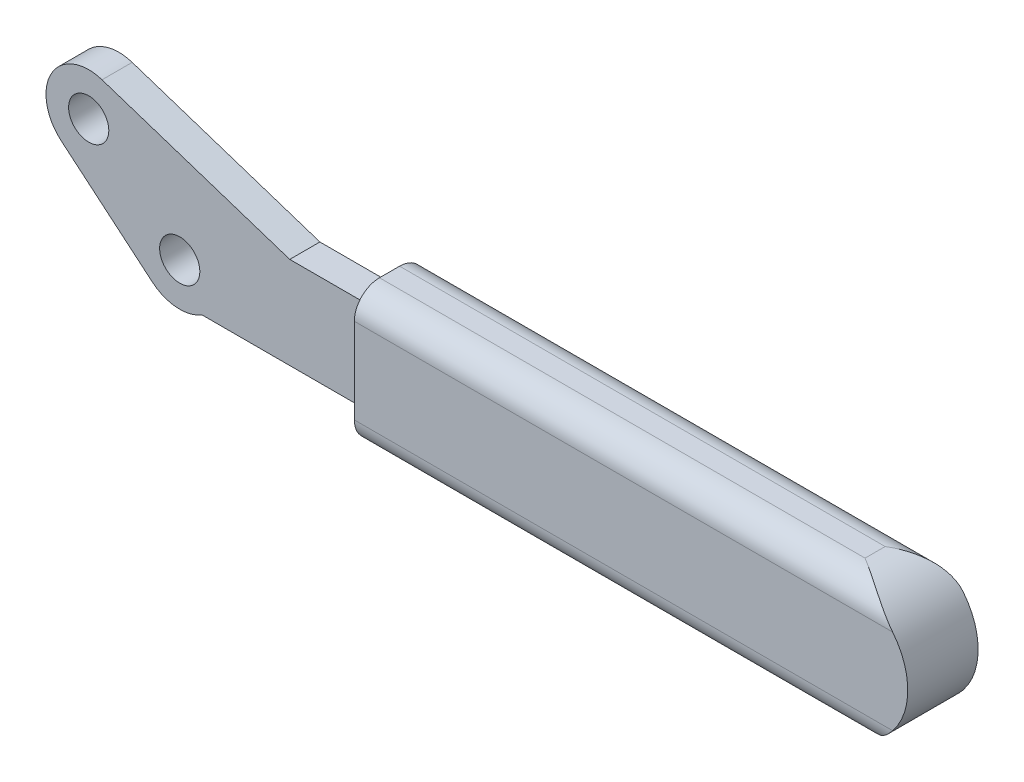
from build123d import *

# Parameters (mm, degrees)
EXTRUDE_1_DEPTH          = 3
EXTRUDE_1_DEPTH_BACK     = 3
SKETCH_1_R               = 4
EXTRUDE_2_DEPTH          = 110.134
CUT_EXTRUDE_1_DEPTH      = 7
CUT_EXTRUDE_1_DEPTH_BACK = 7


with BuildPart() as part:
    # 草图1 → 凸台-拉伸1 (new, two sides: drawn at the far end of the back side and taken through both)
    with BuildSketch(Plane.XY.offset(-EXTRUDE_1_DEPTH_BACK)):
        with BuildLine():
            Line((-23.589809211, 8.747299509), (-5.474019211, -6.502700491))
            ThreePointArc((-5.474019211, -6.502700491), (-0.63908945, -8.475940342), (4.437059837, -7.25))
            Line((4.437059837, -7.25), (38.75, -7.25))
            Line((38.75, -7.25), (38.75, 11.05))
            Line((38.75, 11.05), (21.8949318, 11.05))
            Line((21.8949318, 11.05), (-15.462352545, 23.325225673))
            ThreePointArc((-15.462352545, 23.325225673), (-25.539933262, 19.389093721), (-23.589809211, 8.747299509))
        make_face()
        Circle(SKETCH_1_R, mode=Mode.SUBTRACT)
        with Locations((-18.11579, 15.25)):
            Circle(SKETCH_1_R, mode=Mode.SUBTRACT)
    extrude(amount=EXTRUDE_1_DEPTH + EXTRUDE_1_DEPTH_BACK)

    # 草图2 → 凸台-拉伸2 (add)
    with BuildSketch(Plane(origin=(38.75, 0, 0), x_dir=(0, 0, -1), z_dir=(1, 0, 0))):
        with BuildLine():
            Line((-7, 10.81), (-7, -6.19))
            ThreePointArc((-7, -6.19), (-5.535533906, -9.725533906), (-2, -11.19))
            Line((-2, -11.19), (2, -11.19))
            ThreePointArc((2, -11.19), (5.535533906, -9.725533906), (7, -6.19))
            Line((7, -6.19), (7, 10.81))
            ThreePointArc((7, 10.81), (5.535533906, 14.345533906), (2, 15.81))
            Line((2, 15.81), (-2, 15.81))
            ThreePointArc((-2, 15.81), (-5.535533906, 14.345533906), (-7, 10.81))
        make_face()
    extrude(amount=EXTRUDE_2_DEPTH)

    # 草图3 → 切除-拉伸1 (cut, two sides: drawn at the far end of the back side and taken through both)
    with BuildSketch(Plane.XY.offset(-CUT_EXTRUDE_1_DEPTH_BACK)):
        with BuildLine():
            Line((38.75, 15.81), (135.384, 15.81))
            ThreePointArc((135.384, 15.81), (148.881430926, 2.573359834), (135.910619432, -11.179724681))
            ThreePointArc((135.910619432, -11.179724681), (135.416543333, -11.158219373), (134.932713501, -11.055835964))
            ThreePointArc((134.932713501, -11.055835964), (126.070501893, -9.711605063), (117.183142857, -10.878052953))
            ThreePointArc((117.183142857, -10.878052953), (116.38, -10.987557918), (115.576857143, -10.878052953))
            ThreePointArc((115.576857143, -10.878052953), (106.886506673, -9.710238292), (98.205428571, -10.945092687))
            ThreePointArc((98.205428571, -10.945092687), (97.379999908, -11.060882627), (96.554571252, -10.945092637))
            ThreePointArc((96.554571252, -10.945092637), (87.873493235, -9.710238291), (79.183142857, -10.878052953))
            ThreePointArc((79.183142857, -10.878052953), (78.38, -10.987557918), (77.576857143, -10.878052953))
            ThreePointArc((77.576857143, -10.878052953), (68.676784071, -9.711734935), (59.802929496, -11.063142857))
            ThreePointArc((59.802929496, -11.063142857), (59.375984144, -11.158116286), (58.939766636, -11.19))
            Line((58.939766636, -11.19), (38.75, -11.19))
            Line((38.75, -11.19), (38.75, -16.19))
            Line((38.75, -16.19), (153.884, -16.19))
            Line((153.884, -16.19), (153.884, 20.81))
            Line((153.884, 20.81), (38.75, 20.81))
            Line((38.75, 20.81), (38.75, 15.81))
        make_face()
    extrude(amount=CUT_EXTRUDE_1_DEPTH + CUT_EXTRUDE_1_DEPTH_BACK, mode=Mode.SUBTRACT)


solid = part.part
